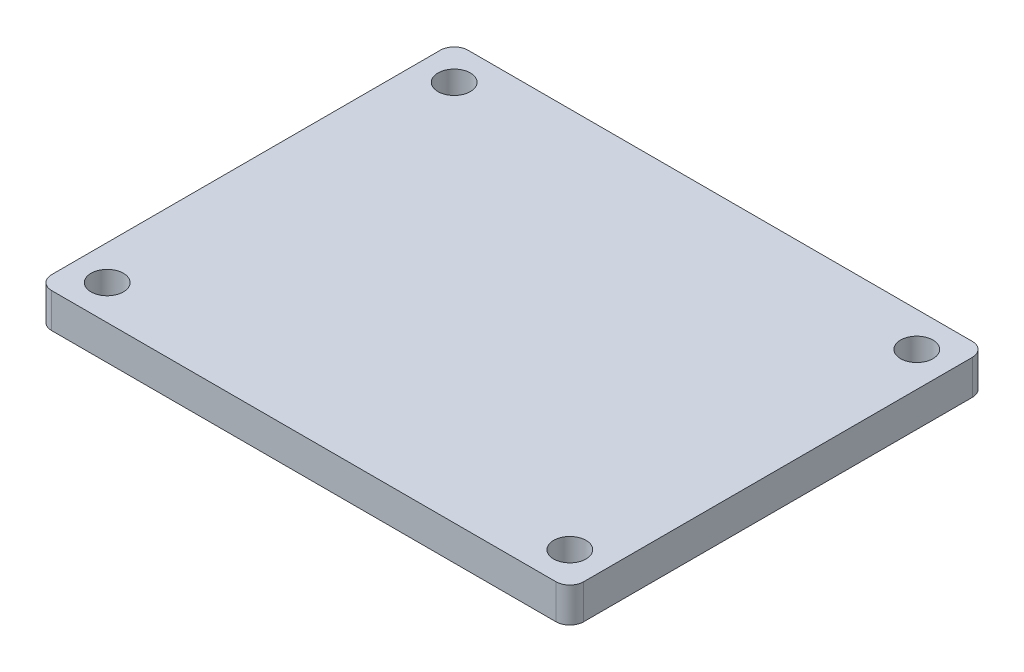
from build123d import *

# Parameters (mm, degrees)
BOSS_EXTRUDE1_DEPTH  = 7.5
M6_CLEARANCE_HOLE1_D = 7


with BuildPart() as part:
    # Sketch1 → Boss-Extrude1 (new body)
    with BuildSketch(Plane(origin=(0, 0, 0), x_dir=(1, 0, 0), z_dir=(0, 1, 0))):
        with BuildLine():
            Line((54.5, -45), (-54.5, -45))
            ThreePointArc((-54.5, -45), (-56.621320344, -44.121320344), (-57.5, -42))
            Line((-57.5, -42), (-57.5, 42))
            ThreePointArc((-57.5, 42), (-56.621320344, 44.121320344), (-54.5, 45))
            Line((-54.5, 45), (54.5, 45))
            ThreePointArc((54.5, 45), (56.621320344, 44.121320344), (57.5, 42))
            Line((57.5, 42), (57.5, -42))
            ThreePointArc((57.5, -42), (56.621320344, -44.121320344), (54.5, -45))
        make_face()
    extrude(amount=BOSS_EXTRUDE1_DEPTH)

    # M6 Clearance Hole1 (through all)
    with Locations(Plane(origin=(0, 7.5, 0), x_dir=(1, 0, 0), z_dir=(0, 1, 0))):
        with Locations((-50, 37.5), (50, 37.5), (50, -37.5), (-50, -37.5)):
            Hole(M6_CLEARANCE_HOLE1_D / 2)


solid = part.part
